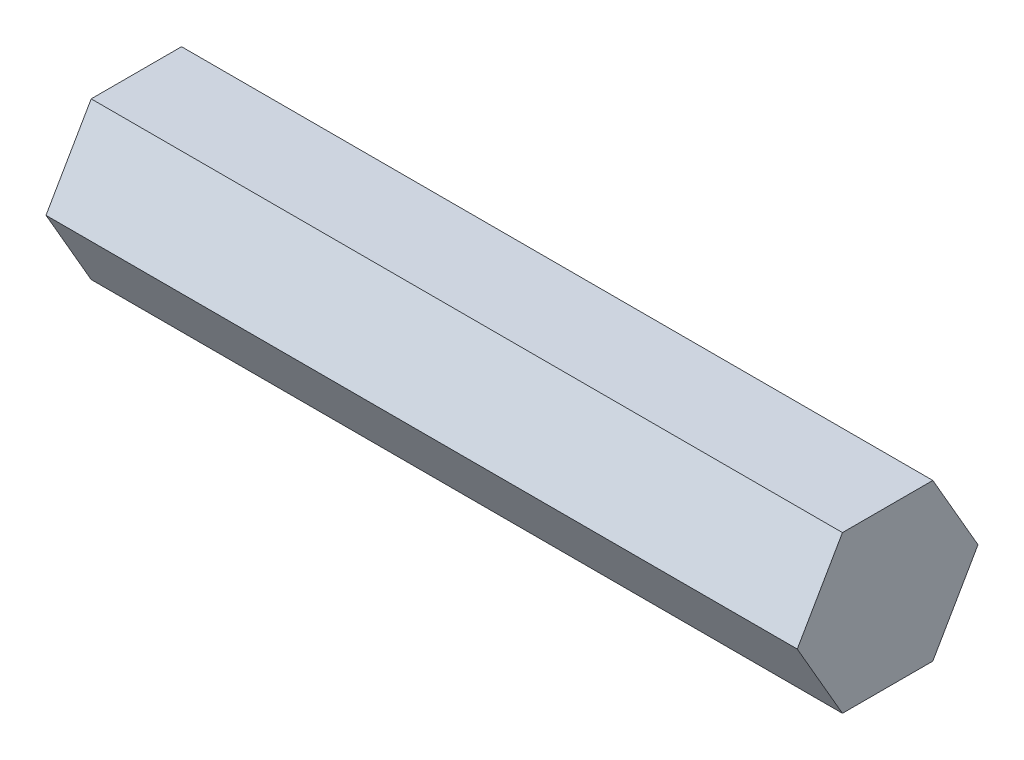
from build123d import *

# Parameters (mm, degrees)
BOSS_EXTRUDE1_DEPTH = 60.96


with BuildPart() as part:
    # Sketch1 → Boss-Extrude1 (new body)
    with BuildSketch(Plane(origin=(0, 0, 0), x_dir=(0, 0, -1), z_dir=(1, 0, 0))):
        Polygon((7.332348419, 0), (3.666174209, 6.35), (-3.666174209, 6.35), (-7.332348419, 0), (-3.666174209, -6.35), (3.666174209, -6.35), align=None)
    extrude(amount=BOSS_EXTRUDE1_DEPTH)


solid = part.part
